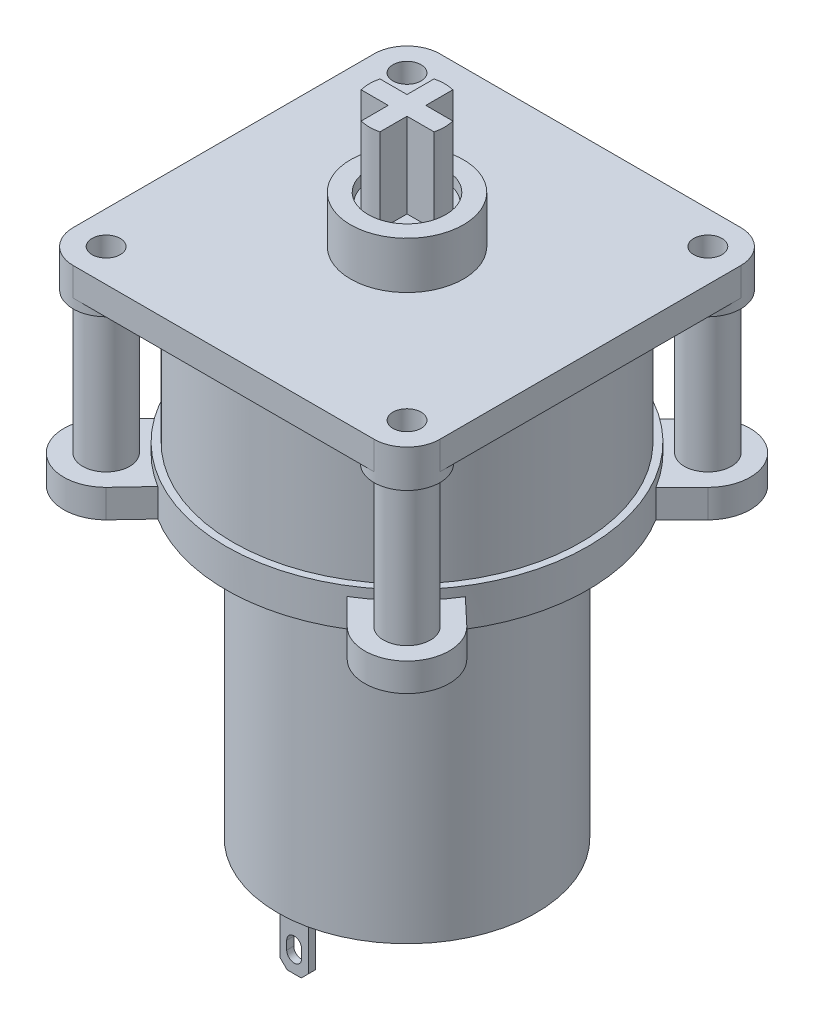
from build123d import *
from build123d.topology import SkipClean

# Parameters (mm, degrees)
SKETCH1_R                   = 13.75
MOTOR_BODY_DEPTH            = 32.5
SKETCH7_R                   = 5
MOTOR_TIP_DEPTH             = 3
SKETCH8_W                   = 3
SKETCH8_H                   = 0.75
MOTOR_CONTACTS_DEPTH        = 6.5
MOTOR_CONTACTS_CHAMFER_SIZE = 0.75
MOTOR_CONTACTS_HOLE_DEPTH   = 23.25
CONNECTION_BOT_1_DEPTH      = 3
SKETCH14_R                  = 19.25
CONNECTION_BOT_2_DEPTH      = 1
SKETCH10_R                  = 18.5
CONNECTION_MID_DEPTH        = 15
CONNECTION_TOP_1_DEPTH      = 3
CONNECTION_TOP_2_START      = 1
SKETCH12_R                  = 3.5
CONNECTION_TOP_2_DEPTH      = 1
SKETCH13_R                  = 2.5
SCREW_HOLDERS_DEPTH         = 15
SKETCH3_R                   = 1.5
SCREW_HOLES_DEPTH           = 22
SKETCH15_R                  = 6
SKETCH15_R_2                = 4.125
MOTOR_SHAFT_GUIDE_DEPTH     = 5
SKETCH16_R                  = 4
MOTOR_SHAFT_BOT_DEPTH       = 4
MOTOR_SHAFT_DEPTH           = 9


with BuildPart() as part:
    # Sketch1 → motor_body (new body)
    with BuildSketch(Plane(origin=(0, 0, 0), x_dir=(1, 0, 0), z_dir=(0, 1, 0))):
        with Locations(Location((0, 0, 0), (0, 0, 270))):
            Circle(SKETCH1_R)
    extrude(amount=MOTOR_BODY_DEPTH)

    # Sketch7 → motor_tip (add)
    with BuildSketch(Plane.XZ):
        with Locations(Location((0, 0, 0), (0, 0, 270))):
            Circle(SKETCH7_R)
    extrude(amount=MOTOR_TIP_DEPTH)

    # Sketch8 → motor_contacts (add)
    with BuildSketch(Plane.XZ):
        with Locations((0, 11.625)):
            Rectangle(SKETCH8_W, SKETCH8_H)
        with Locations((0, -11.625)):
            Rectangle(SKETCH8_W, SKETCH8_H)
    extrude(amount=MOTOR_CONTACTS_DEPTH)

    # motor_contacts_chamfer
    motor_contacts_chamfer_edges = [part.edges().sort_by_distance(p)[0] for p in [
        (1.5, -6.5, 11.625),
        (-1.5, -6.5, 11.625),
        (-1.5, -6.5, -11.625),
        (1.5, -6.5, -11.625),
    ]]
    chamfer(motor_contacts_chamfer_edges, length=MOTOR_CONTACTS_CHAMFER_SIZE)

    # Sketch9 → motor_contacts_hole (cut)
    with BuildSketch(Plane.XY.offset(12)):
        with BuildLine():
            Line((0.79375, -3.79375), (0.79375, -4.70625))
            ThreePointArc((0.79375, -4.70625), (0, -5.5), (-0.79375, -4.70625))
            Line((-0.79375, -4.70625), (-0.79375, -3.79375))
            ThreePointArc((-0.79375, -3.79375), (0, -3), (0.79375, -3.79375))
        make_face()
    motor_contacts_hole = extrude(amount=-MOTOR_CONTACTS_HOLE_DEPTH, mode=Mode.SUBTRACT)

    # motor_contacts_hole2: motor_contacts_hole across plane
    add(motor_contacts_hole.mirror(Plane.XY), mode=Mode.SUBTRACT)

    # Sketch2 → connection_bot_1 (add)
    with BuildSketch(Plane(origin=(0, 32.5, 0), x_dir=(1, 0, 0), z_dir=(0, 1, 0))):
        with BuildLine():
            Line((19.181980515, 12.818019485), (16.416641448, 10.052680417))
            ThreePointArc((16.416641448, 10.052680417), (19.24991098, -0.058542722), (16.355194034, -10.152345941))
            Line((16.355194034, -10.152345941), (19.181980515, -12.818019485))
            ThreePointArc((19.181980515, -12.818019485), (19.181980515, -19.181980515), (12.818019485, -19.181980515))
            Line((12.818019485, -19.181980515), (10.052680417, -16.416641448))
            ThreePointArc((10.052680417, -16.416641448), (-0.058542722, -19.24991098), (-10.152345941, -16.355194034))
            Line((-10.152345941, -16.355194034), (-12.818019485, -19.181980515))
            ThreePointArc((-12.818019485, -19.181980515), (-19.181980515, -19.181980515), (-19.181980515, -12.818019485))
            Line((-19.181980515, -12.818019485), (-16.416641448, -10.052680417))
            ThreePointArc((-16.416641448, -10.052680417), (-19.24991098, 0.058542722), (-16.355194034, 10.152345941))
            Line((-16.355194034, 10.152345941), (-19.181980515, 12.818019485))
            ThreePointArc((-19.181980515, 12.818019485), (-19.181980515, 19.181980515), (-12.818019485, 19.181980515))
            Line((-12.818019485, 19.181980515), (-10.052680417, 16.416641448))
            ThreePointArc((-10.052680417, 16.416641448), (0.058542722, 19.24991098), (10.152345941, 16.355194034))
            Line((10.152345941, 16.355194034), (12.818019485, 19.181980515))
            ThreePointArc((12.818019485, 19.181980515), (19.181980515, 19.181980515), (19.181980515, 12.818019485))
        make_face()
    extrude(amount=CONNECTION_BOT_1_DEPTH)

    # Sketch14 → connection_bot_2 (add)
    with BuildSketch(Plane(origin=(0, 35.5, 0), x_dir=(1, 0, 0), z_dir=(0, 1, 0))):
        with Locations(Location((0, 0, 0), (0, 0, 121.48109236))):
            Circle(SKETCH14_R)
    extrude(amount=CONNECTION_BOT_2_DEPTH)

    # Sketch10 → connection_mid (add)
    with BuildSketch(Plane(origin=(0, 36.5, 0), x_dir=(1, 0, 0), z_dir=(0, 1, 0))):
        with Locations(Location((0, 0, 0), (0, 0, 270))):
            Circle(SKETCH10_R)
    extrude(amount=CONNECTION_MID_DEPTH)

    # Sketch11 → connection_top_1 (add)
    with SkipClean():  # the faces are left unmerged after this step: merging them gives an invalid solid
        with BuildSketch(Plane(origin=(0, 51.5, 0), x_dir=(1, 0, 0), z_dir=(0, 1, 0))):
            with BuildLine():
                Line((-16, 19.5), (16, 19.5))
                ThreePointArc((16, 19.5), (18.474873734, 18.474873734), (19.5, 16))
                Line((19.5, 16), (19.5, -16))
                ThreePointArc((19.5, -16), (18.474873734, -18.474873734), (16, -19.5))
                Line((16, -19.5), (-16, -19.5))
                ThreePointArc((-16, -19.5), (-18.474873734, -18.474873734), (-19.5, -16))
                Line((-19.5, -16), (-19.5, 16))
                ThreePointArc((-19.5, 16), (-18.474873734, 18.474873734), (-16, 19.5))
            make_face()
        extrude(amount=CONNECTION_TOP_1_DEPTH)

    # Sketch12 → connection_top_2 (add)
    with SkipClean():  # the faces are left unmerged after this step: merging them gives an invalid solid
        with BuildSketch(Plane.XZ.offset(-51.5).offset(CONNECTION_TOP_2_START)):
            with Locations(Location((-16, 16, 0), (0, 0, 270))):
                Circle(SKETCH12_R)
            with Locations(Location((16, 16, 0), (0, 0, 270))):
                Circle(SKETCH12_R)
            with Locations(Location((16, -16, 0), (0, 0, 270))):
                Circle(SKETCH12_R)
            with Locations(Location((-16, -16, 0), (0, 0, 270))):
                Circle(SKETCH12_R)
        extrude(amount=-CONNECTION_TOP_2_DEPTH)

    # Sketch13 → screw_holders (add)
    with SkipClean():  # the faces are left unmerged after this step: merging them gives an invalid solid
        with BuildSketch(Plane(origin=(0, 35.5, 0), x_dir=(1, 0, 0), z_dir=(0, 1, 0))):
            with Locations(Location((-16, -16, 0), (0, 0, 90))):
                Circle(SKETCH13_R)
            with Locations(Location((-16, 16, 0), (0, 0, 90))):
                Circle(SKETCH13_R)
            with Locations(Location((16, 16, 0), (0, 0, 90))):
                Circle(SKETCH13_R)
            with Locations(Location((16, -16, 0), (0, 0, 90))):
                Circle(SKETCH13_R)
        extrude(amount=SCREW_HOLDERS_DEPTH)

    # Sketch3 → screw_holes (cut)
    with SkipClean():  # the faces are left unmerged after this step: merging them gives an invalid solid
        with BuildSketch(Plane(origin=(0, 54.5, 0), x_dir=(1, 0, 0), z_dir=(0, 1, 0))):
            with Locations(Location((-16, 16, 0), (0, 0, 270))):
                Circle(SKETCH3_R)
            with Locations(Location((16, 16, 0), (0, 0, 270))):
                Circle(SKETCH3_R)
            with Locations(Location((16, -16, 0), (0, 0, 270))):
                Circle(SKETCH3_R)
            with Locations(Location((-16, -16, 0), (0, 0, 270))):
                Circle(SKETCH3_R)
        extrude(amount=-SCREW_HOLES_DEPTH, mode=Mode.SUBTRACT)

    # Sketch15 → motor_shaft_guide_ (add)
    with SkipClean():  # the faces are left unmerged after this step: merging them gives an invalid solid
        with BuildSketch(Plane(origin=(0, 54.5, 0), x_dir=(1, 0, 0), z_dir=(0, 1, 0))):
            with Locations(Location((0, 0, 0), (0, 0, 270))):
                Circle(SKETCH15_R)
            with Locations(Location((0, 0, 0), (0, 0, 270))):
                Circle(SKETCH15_R_2, mode=Mode.SUBTRACT)
        extrude(amount=MOTOR_SHAFT_GUIDE_DEPTH)

    # Sketch16 → motor_shaft_bot (add)
    with SkipClean():  # the faces are left unmerged after this step: merging them gives an invalid solid
        with BuildSketch(Plane(origin=(0, 54.5, 0), x_dir=(1, 0, 0), z_dir=(0, 1, 0))):
            with Locations(Location((0, 0, 0), (0, 0, 270))):
                Circle(SKETCH16_R)
        extrude(amount=MOTOR_SHAFT_BOT_DEPTH)

    # Sketch17 → motor_shaft_ (add)
    with SkipClean():  # the faces are left unmerged after this step: merging them gives an invalid solid
        with BuildSketch(Plane(origin=(0, 58.5, 0), x_dir=(1, 0, 0), z_dir=(0, 1, 0))):
            with BuildLine():
                Line((-1, -1), (-1, -3.872983346))
                ThreePointArc((-1, -3.872983346), (0, -4), (1, -3.872983346))
                Line((1, -3.872983346), (1, -1))
                Line((1, -1), (3.872983346, -1))
                ThreePointArc((3.872983346, -1), (4, 0), (3.872983346, 1))
                Line((3.872983346, 1), (1, 1))
                Line((1, 1), (1, 3.872983346))
                ThreePointArc((1, 3.872983346), (0, 4), (-1, 3.872983346))
                Line((-1, 3.872983346), (-1, 1))
                Line((-1, 1), (-3.872983346, 1))
                ThreePointArc((-3.872983346, 1), (-4, 0), (-3.872983346, -1))
                Line((-3.872983346, -1), (-1, -1))
            make_face()
        extrude(amount=MOTOR_SHAFT_DEPTH)


solid = part.part
